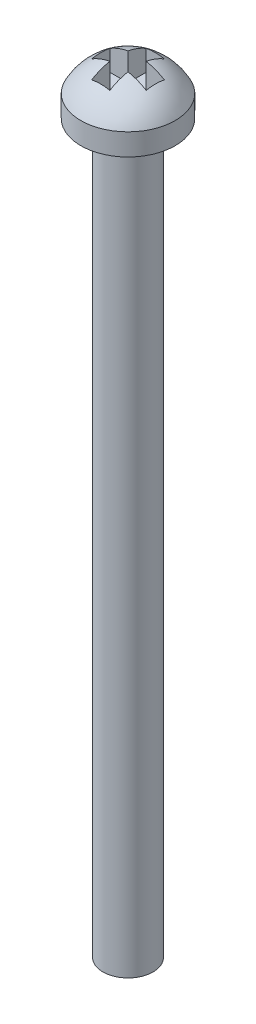
from build123d import *

# Parameters (mm, degrees)
CUT_EXTRUDE1_REACH      = 54.532
CUT_EXTRUDE1_END_RADIUS = 3.68985638


with BuildPart() as part:
    # Sketch1 → Revolve1 (revolve)
    with BuildSketch(Plane.XY, mode=Mode.PRIVATE) as revolve1_sk:
        Polygon((0, 50.677234653), (0, 0), (1.7526, 0), (1.7526, 50.8), (0, 50.8), align=None)
        with BuildLine():
            Line((0, 54.367091034), (0, 50.8))
            Line((0, 50.8), (1.7526, 50.8))
            Line((1.7526, 50.8), (3.302, 50.8))
            Line((3.302, 50.8), (3.302, 52.324))
            ThreePointArc((3.302, 52.324), (1.941483001, 53.815017926), (0, 54.367091034))
        make_face()
    revolve(revolve1_sk.sketch.rotate(Axis((0, -8.932338451, 0), (0, 1, 0)), 90), axis=Axis((0, -8.932338451, 0), (0, 1, 0)))

    # Cut-Extrude1: up to this sphere (the profile starts inside it)
    cut_extrude1_end = Location((0, 50.677234653, 0)) * Sphere(CUT_EXTRUDE1_END_RADIUS, mode=Mode.PRIVATE)
    # Sketch2 → Cut-Extrude1 (cut, up to the surface)
    with BuildSketch(Plane(origin=(0, 52.324, 0), x_dir=(-1, 0, 0), z_dir=(0, -1, 0)), mode=Mode.PRIVATE) as cut_extrude1_sk1:
        Polygon((0.635, 0.635), (1.905, 0.635), (1.905, -0.635), (0.635, -0.635), (0.635, -1.905), (-0.635, -1.905), (-0.635, -0.635), (-1.905, -0.635), (-1.905, 0.635), (-0.635, 0.635), (-0.635, 1.905), (0.635, 1.905), align=None)
    cut_extrude1_tool1 = extrude(cut_extrude1_sk1.sketch, amount=-CUT_EXTRUDE1_REACH, mode=Mode.PRIVATE) & cut_extrude1_end
    add(cut_extrude1_tool1.solids().sort_by_distance((0, 52.324, 0))[0], mode=Mode.SUBTRACT)


solid = part.part
